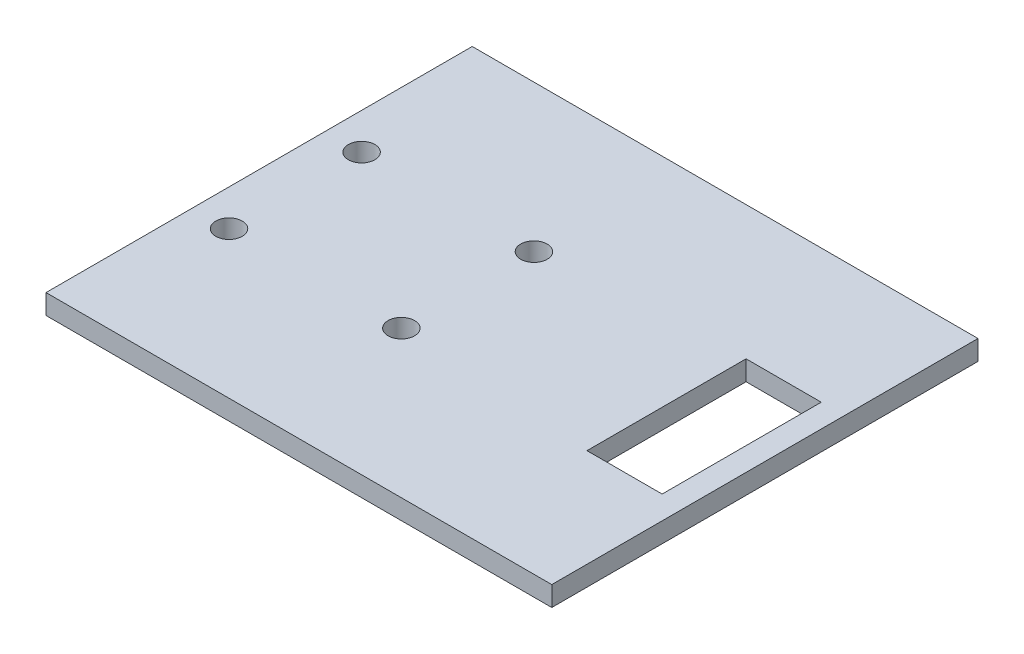
from build123d import *

# Parameters (mm, degrees)
SKETCH1_W           = 76.3
SKETCH1_H           = 64.3
BOSS_EXTRUDE1_DEPTH = 3
SKETCH4_R           = 2
SKETCH4_W           = 11.340165237
SKETCH4_H           = 24
CUT_EXTRUDE2_DEPTH  = 100.825748182


with BuildPart() as part:
    # Sketch1 → Boss-Extrude1 (new body)
    with BuildSketch(Plane(origin=(0, 0, 0), x_dir=(1, 0, 0), z_dir=(0, 1, 0))):
        with Locations((38.15, -32.15)):
            Rectangle(SKETCH1_W, SKETCH1_H)
    extrude(amount=BOSS_EXTRUDE1_DEPTH)

    # Sketch4 → Cut-Extrude2 (cut, through all)
    with BuildSketch(Plane(origin=(0, 3, 0), x_dir=(1, 0, 0), z_dir=(0, 1, 0))):
        with Locations(Location((5.459834763, -22.15, 0), (0, 0, 270))):
            Circle(SKETCH4_R)
        with Locations(Location((31.459834763, -22.15, 0), (0, 0, 270))):
            Circle(SKETCH4_R)
        with Locations(Location((5.459834763, -42.15, 0), (0, 0, 270))):
            Circle(SKETCH4_R)
        with Locations(Location((31.459834763, -42.15, 0), (0, 0, 270))):
            Circle(SKETCH4_R)
        with Locations((67.129917382, -32.15)):
            Rectangle(SKETCH4_W, SKETCH4_H)
    extrude(amount=-CUT_EXTRUDE2_DEPTH, mode=Mode.SUBTRACT)


solid = part.part
